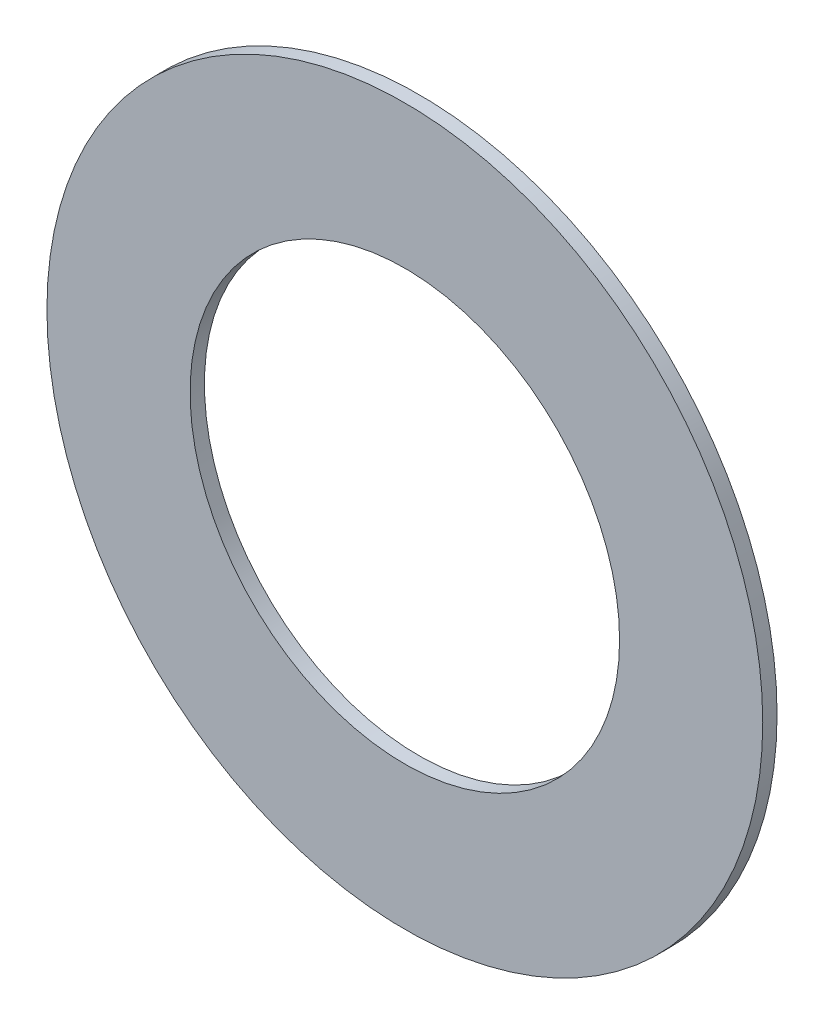
from build123d import *

# Parameters (mm, degrees)
SKETCH_1_R      = 2.5
SKETCH_1_R_2    = 1.5
EXTRUDE_1_DEPTH = 0.1


with BuildPart() as part:
    # 草图1 → 凸台-拉伸1 (new body)
    with BuildSketch(Plane.XY):
        Circle(SKETCH_1_R)
        Circle(SKETCH_1_R_2, mode=Mode.SUBTRACT)
    extrude(amount=EXTRUDE_1_DEPTH)


solid = part.part
